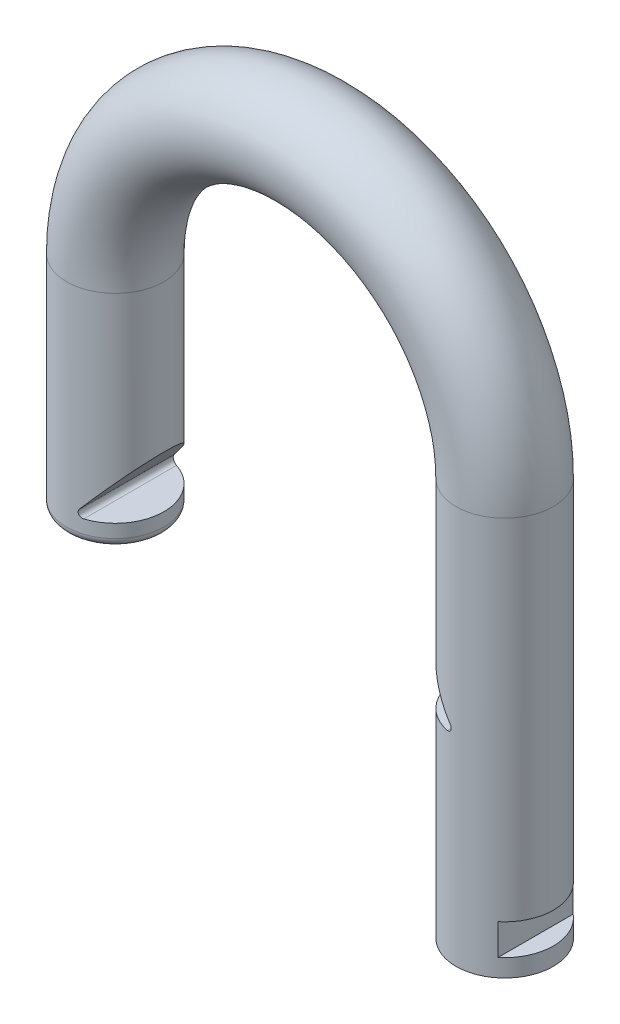
from build123d import *

# Parameters (mm, degrees)
SWEEP_1_PROFILE_R        = 5.5
FILLET_1_R               = 1
CUT_EXTRUDE_1_DEPTH      = 54.023579723
CUT_EXTRUDE_1_DEPTH_BACK = 54.023579723
FILLET_2_R               = 0.5
CUT_EXTRUDE_2_DEPTH      = 54.023579723
CUT_EXTRUDE_2_DEPTH_BACK = 54.023579723
SKETCH_11_W              = 2
SKETCH_11_H              = 3.5
CUT_EXTRUDE_3_DEPTH      = 54.023579723
CUT_EXTRUDE_3_DEPTH_BACK = 54.023579723
CUT_EXTRUDE_4_DEPTH      = 54.023579723
CUT_EXTRUDE_4_DEPTH_BACK = 54.023579723
FILLET_3_R               = 0.5


with BuildPart() as part:
    # 扫描1: sweep along a path in 草图2
    with BuildLine(Plane.XY) as sweep_1_path:
        Line((-22, -25), (-22, 0))
        ThreePointArc((-22, 0), (0, 22), (22, 0))
        Line((22, 0), (22, -45))
    # 扫描1 profile (on start of the path) → 扫描1 (sweep)
    with BuildSketch(Plane(origin=(-22, -25, 0), x_dir=(1, 0, 0), z_dir=(0, 1, 0))):
        Circle(SWEEP_1_PROFILE_R)
    sweep(path=sweep_1_path.line)

    # 圆角1
    fillet_1_edges = [part.edges().sort_by_distance(p)[0] for p in [
        (-27.5, -25, 0),
    ]]
    fillet(fillet_1_edges, radius=FILLET_1_R)

    # 草图10 → 切除-拉伸1 (cut, two sides: drawn at the far end of the back side and taken through both)
    with BuildSketch(Plane.XY.offset(-CUT_EXTRUDE_1_DEPTH_BACK)):
        Polygon((-16.5, -22.5), (-21.39690683, -22.5), (-16.5, -16.664093693), align=None)
    extrude(amount=CUT_EXTRUDE_1_DEPTH + CUT_EXTRUDE_1_DEPTH_BACK, mode=Mode.SUBTRACT)

    # 圆角2
    fillet_2_edges = [part.edges().sort_by_distance(p)[0] for p in [
        (-21.39690683, -22.5, 0),
    ]]
    fillet(fillet_2_edges, radius=FILLET_2_R)

    # 草图11 → 切除-拉伸2 (cut, two sides: drawn at the far end of the back side and taken through both)
    with BuildSketch(Plane.XY.offset(-CUT_EXTRUDE_2_DEPTH_BACK)):
        with Locations((26.5, -41.25)):
            Rectangle(SKETCH_11_W, SKETCH_11_H)
        with Locations((17.5, -41.25)):
            Rectangle(SKETCH_11_W, SKETCH_11_H)
    extrude(amount=CUT_EXTRUDE_2_DEPTH + CUT_EXTRUDE_2_DEPTH_BACK, mode=Mode.SUBTRACT)

    # 草图12 → 切除-拉伸3 (cut, two sides: drawn at the far end of the back side and taken through both)
    with BuildSketch(Plane.XY.offset(-CUT_EXTRUDE_3_DEPTH_BACK)):
        Polygon((18.5, -39.5), (18.5, -28.5), (16.5, -27.345299462), (16.5, -39.5), align=None)
    extrude(amount=CUT_EXTRUDE_3_DEPTH + CUT_EXTRUDE_3_DEPTH_BACK, mode=Mode.SUBTRACT)

    # 草图13 → 切除-拉伸4 (cut, two sides: drawn at the far end of the back side and taken through both)
    with BuildSketch(Plane.XY.offset(-CUT_EXTRUDE_4_DEPTH_BACK)):
        Polygon((16.5, -22.5), (22, -22.5), (16.5, -15.945355241), align=None)
    extrude(amount=CUT_EXTRUDE_4_DEPTH + CUT_EXTRUDE_4_DEPTH_BACK, mode=Mode.SUBTRACT)

    # 圆角3
    fillet_3_edges = [part.edges().sort_by_distance(p)[0] for p in [
        (22, -22.5, 0),
    ]]
    fillet(fillet_3_edges, radius=FILLET_3_R)


solid = part.part
